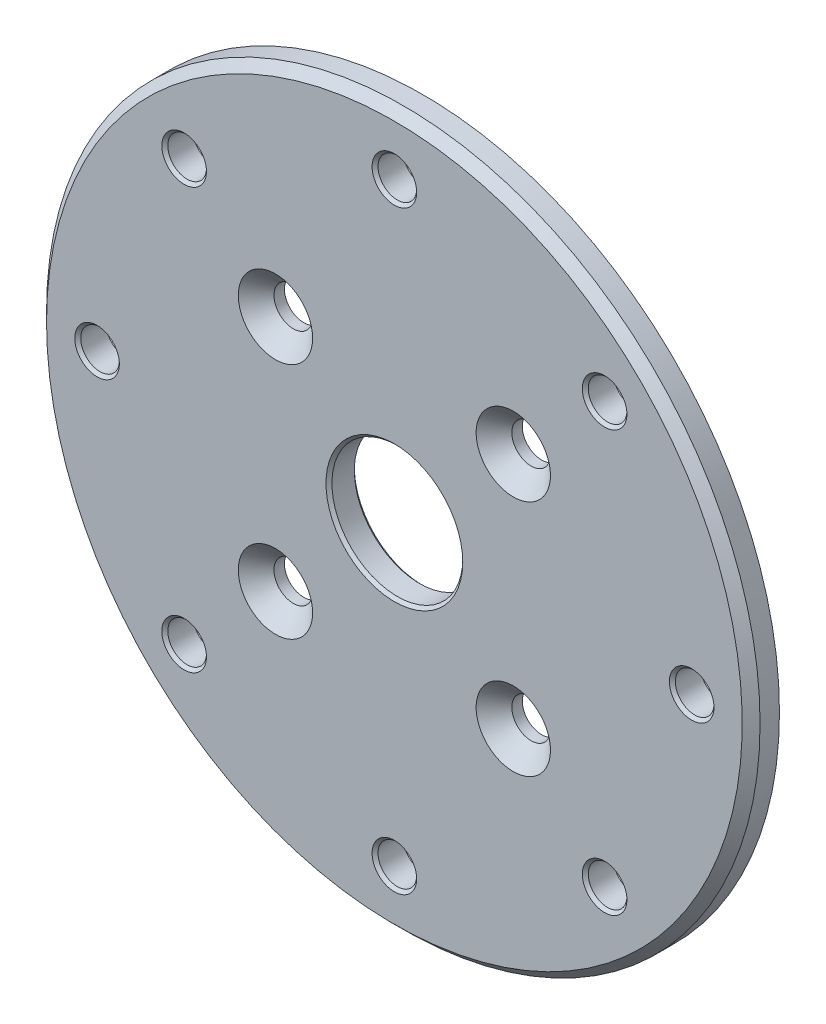
from build123d import *

# Parameters (mm, degrees)
CROQUIS1_R              = 60
SALIENTE_EXTRUIR1_DEPTH = 4.7625
CROQUIS2_R              = 3.25
CORTAR_EXTRUIR1_DEPTH   = 85.986360119
CHAFL_N1_SIZE           = 1.5
CROQUIS3_R              = 11
CORTAR_EXTRUIR2_DEPTH   = 85.986360119
CROQUIS4_R              = 3.25
CORTAR_EXTRUIR3_DEPTH   = 85.986360119
CHAFL_N2_SIZE           = 0.5
CHAFL_N3_SIZE           = 3


with BuildPart() as part:
    # Croquis1 → Saliente-Extruir1 (new body)
    with BuildSketch(Plane.XY):
        with Locations(Location((0, 0, 0), (0, 0, 180))):
            Circle(CROQUIS1_R)
    extrude(amount=SALIENTE_EXTRUIR1_DEPTH)

    # Croquis2 → Cortar-Extruir1 (cut, through all)
    with BuildSketch(Plane.XY.offset(4.7625)):
        with Locations((50, 0)):
            Circle(CROQUIS2_R)
        with Locations((35.355339059, -35.355339059)):
            Circle(CROQUIS2_R)
        with Locations((0, -50)):
            Circle(CROQUIS2_R)
        with Locations((-35.355339059, -35.355339059)):
            Circle(CROQUIS2_R)
        with Locations((-50, 0)):
            Circle(CROQUIS2_R)
        with Locations((-35.355339059, 35.355339059)):
            Circle(CROQUIS2_R)
        with Locations((0, 50)):
            Circle(CROQUIS2_R)
        with Locations((35.355339059, 35.355339059)):
            Circle(CROQUIS2_R)
    extrude(amount=-CORTAR_EXTRUIR1_DEPTH, mode=Mode.SUBTRACT)

    # Chaflán1
    chafl_n1_edges = [part.edges().sort_by_distance(p)[0] for p in [
        (60, 0, 4.7625),
    ]]
    chamfer(chafl_n1_edges, length=CHAFL_N1_SIZE)

    # Croquis3 → Cortar-Extruir2 (cut, through all)
    with BuildSketch(Plane.XY.offset(4.7625)):
        Circle(CROQUIS3_R)
    extrude(amount=-CORTAR_EXTRUIR2_DEPTH, mode=Mode.SUBTRACT)

    # Croquis4 → Cortar-Extruir3 (cut, through all)
    with BuildSketch(Plane.XY.offset(4.7625)):
        with Locations((20, 20)):
            Circle(CROQUIS4_R)
        with Locations((-20, 20)):
            Circle(CROQUIS4_R)
        with Locations((-20, -20)):
            Circle(CROQUIS4_R)
        with Locations((20, -20)):
            Circle(CROQUIS4_R)
    extrude(amount=-CORTAR_EXTRUIR3_DEPTH, mode=Mode.SUBTRACT)

    # Chaflán2
    chafl_n2_edges = [part.edges().sort_by_distance(p)[0] for p in [
        (32.105339059, -35.355339059, 4.7625),
        (-3.25, -50, 4.7625),
        (-38.605339059, -35.355339059, 4.7625),
        (-53.25, 0, 4.7625),
        (-38.605339059, 35.355339059, 4.7625),
        (-3.25, 50, 4.7625),
        (32.105339059, 35.355339059, 4.7625),
        (-11, 0, 0),
        (-11, 0, 4.7625),
        (46.75, 0, 4.7625),
    ]]
    chamfer(chafl_n2_edges, length=CHAFL_N2_SIZE)

    # Chaflán3
    chafl_n3_edges = [part.edges().sort_by_distance(p)[0] for p in [
        (16.75, 20, 4.7625),
        (-23.25, 20, 4.7625),
        (-23.25, -20, 4.7625),
        (16.75, -20, 4.7625),
    ]]
    chamfer(chafl_n3_edges, length=CHAFL_N3_SIZE)


solid = part.part
